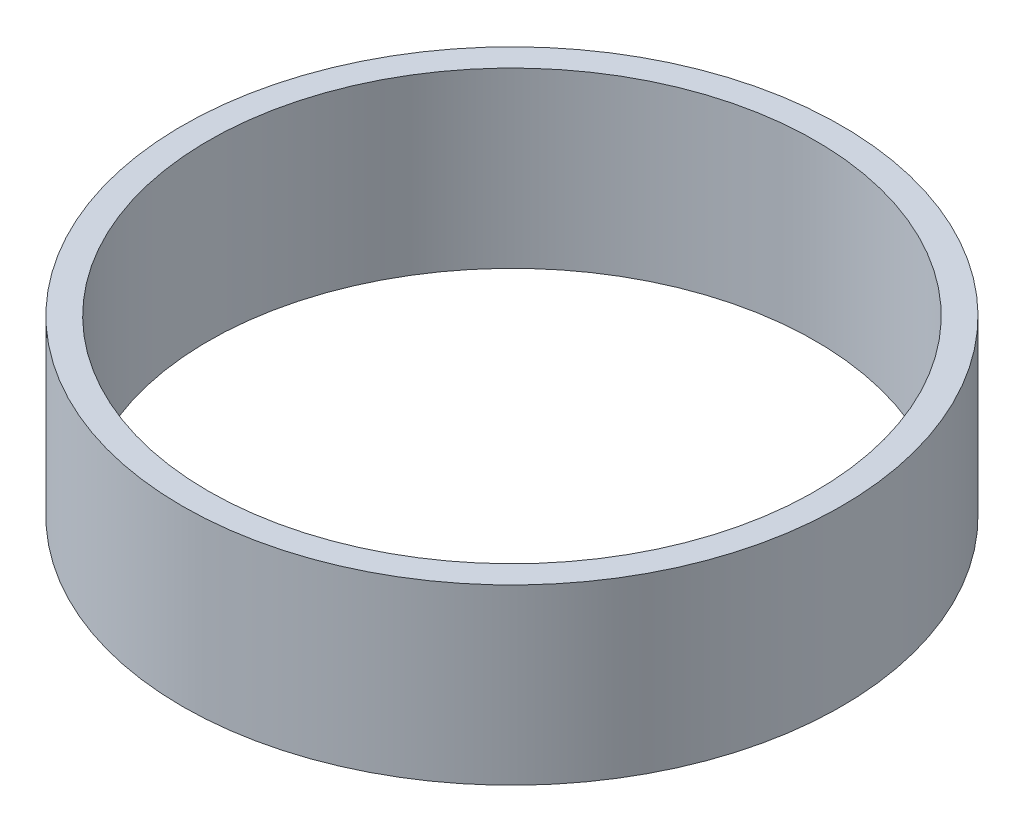
from build123d import *

# Parameters (mm, degrees)
SKETCH3_R           = 15.2
SKETCH3_R_2         = 14
BOSS_EXTRUDE2_DEPTH = 8


with BuildPart() as part:
    # Sketch3 → Boss-Extrude2 (new body)
    with BuildSketch(Plane(origin=(0, 0, 0), x_dir=(1, 0, 0), z_dir=(0, 1, 0))):
        with Locations(Location((0, 0, 0), (0, 0, 270))):
            Circle(SKETCH3_R)
        with Locations(Location((0, 0, 0), (0, 0, 270))):
            Circle(SKETCH3_R_2, mode=Mode.SUBTRACT)
    extrude(amount=BOSS_EXTRUDE2_DEPTH)


solid = part.part
